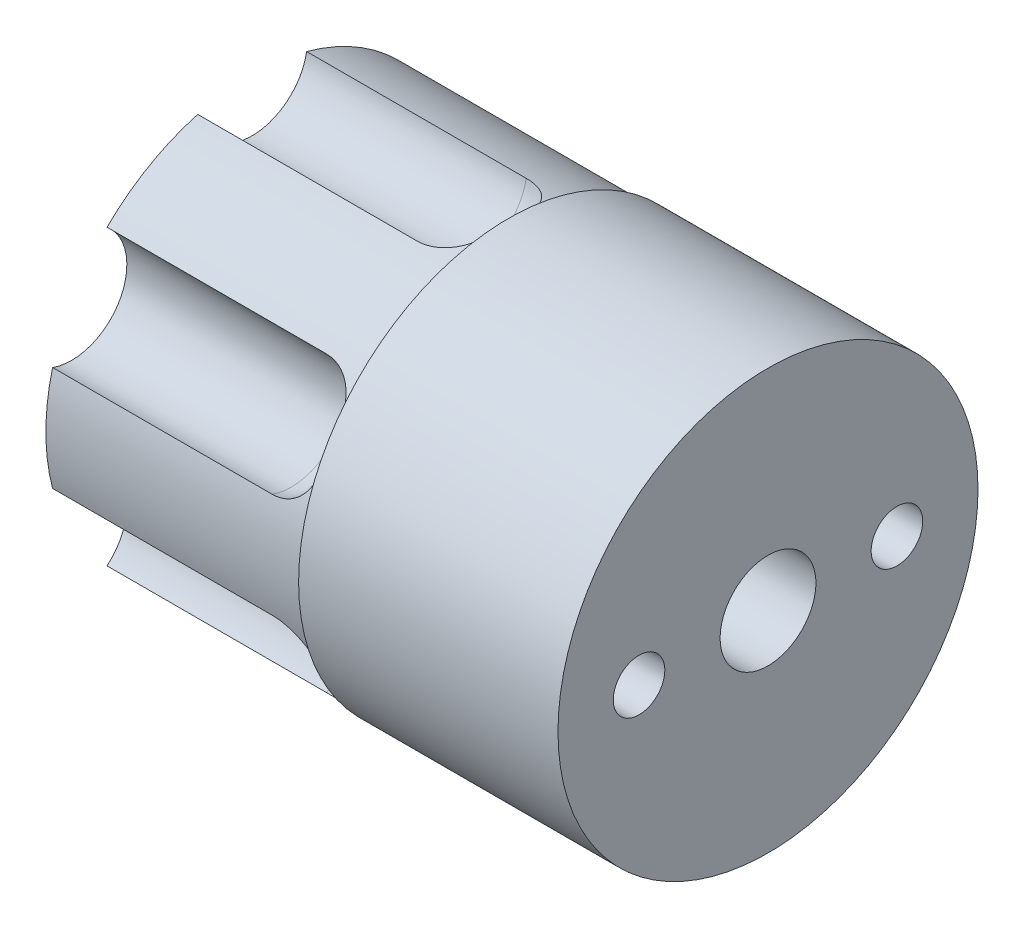
from build123d import *

# Parameters (mm, degrees)
CUT_EXTRUDE_1_DEPTH = 34.8
FILLET_1_R          = 5
CUT_EXTRUDE_2_REACH = 82.774
SKETCH_3_R          = 3.5


with BuildPart() as part:
    # Эскиз1 → Повернуть1 (revolve)
    with BuildSketch(Plane.XY, mode=Mode.PRIVATE) as revolve_1_sk:
        Polygon((0, 6.5), (15.2, 6.5), (15.2, 9.5), (4.7, 9.5), (4.7, 17.5), (35.2, 17.5), (35.2, 22.5), (55, 22.5), (55, 6.5), (70, 6.5), (70, 28.5), (34.8, 28.5), (34.8, 28), (0, 28), align=None)
    revolve(revolve_1_sk.sketch.rotate(Axis((-15.709814328, 0, 0), (1, 0, 0)), 90), axis=Axis((-15.709814328, 0, 0), (1, 0, 0)))

    # Эскиз2 → Вырез-Вытянуть1 (cut)
    with BuildSketch(Plane.ZY):
        with BuildLine():
            ThreePointArc((-7.5, 28.272115237), (0, 20.8), (7.5, 28.272115237))
            ThreePointArc((7.5, 28.272115237), (0, 29.25), (-7.5, 28.272115237))
        make_face()
        with BuildLine():
            ThreePointArc((20.734370014, 20.631248147), (18.013328399, 10.4), (28.234370014, 7.64086709))
            ThreePointArc((28.234370014, 7.64086709), (25.331243061, 14.625), (20.734370014, 20.631248147))
        make_face()
        with BuildLine():
            ThreePointArc((28.234370014, -7.64086709), (18.013328399, -10.4), (20.734370014, -20.631248147))
            ThreePointArc((20.734370014, -20.631248147), (25.331243061, -14.625), (28.234370014, -7.64086709))
        make_face()
        with BuildLine():
            ThreePointArc((7.5, -28.272115237), (0, -20.8), (-7.5, -28.272115237))
            ThreePointArc((-7.5, -28.272115237), (0, -29.25), (7.5, -28.272115237))
        make_face()
        with BuildLine():
            ThreePointArc((-20.734370014, -20.631248147), (-18.013328399, -10.4), (-28.234370014, -7.64086709))
            ThreePointArc((-28.234370014, -7.64086709), (-25.331243061, -14.625), (-20.734370014, -20.631248147))
        make_face()
        with BuildLine():
            ThreePointArc((-28.234370014, 7.64086709), (-18.013328399, 10.4), (-20.734370014, 20.631248147))
            ThreePointArc((-20.734370014, 20.631248147), (-25.331243061, 14.625), (-28.234370014, 7.64086709))
        make_face()
    extrude(amount=-CUT_EXTRUDE_1_DEPTH, mode=Mode.SUBTRACT)

    # Скругление1
    fillet_1_edges = [part.edges().sort_by_distance(p)[0] for p in [
        (34.8, 20.8, 0),
        (34.8, 10.4, 18.013328399),
        (34.8, -10.4, 18.013328399),
        (34.8, -20.8, 0),
        (34.8, -10.4, -18.013328399),
        (34.8, 10.4, -18.013328399),
    ]]
    fillet(fillet_1_edges, radius=FILLET_1_R)

    # Эскиз3 → Вырез-Вытянуть2 (cut, up to next)
    with BuildSketch(Plane(origin=(70, 0, 0), x_dir=(0, 0, -1), z_dir=(1, 0, 0)), mode=Mode.PRIVATE) as cut_extrude_2_sk1:
        with Locations((-17.5, 0)):
            Circle(SKETCH_3_R)
    cut_extrude_2_tool1 = extrude(cut_extrude_2_sk1.sketch, amount=-CUT_EXTRUDE_2_REACH, mode=Mode.PRIVATE) & part.part
    # Эскиз3 → Вырез-Вытянуть2 (cut, up to next)
    with BuildSketch(Plane(origin=(70, 0, 0), x_dir=(0, 0, -1), z_dir=(1, 0, 0)), mode=Mode.PRIVATE) as cut_extrude_2_sk2:
        with Locations((17.5, 0)):
            Circle(SKETCH_3_R)
    cut_extrude_2_tool2 = extrude(cut_extrude_2_sk2.sketch, amount=-CUT_EXTRUDE_2_REACH, mode=Mode.PRIVATE) & part.part
    add(cut_extrude_2_tool1.solids().sort_by_distance((70, 0, 17.5))[0], mode=Mode.SUBTRACT)
    add(cut_extrude_2_tool2.solids().sort_by_distance((70, 0, -17.5))[0], mode=Mode.SUBTRACT)


solid = part.part
